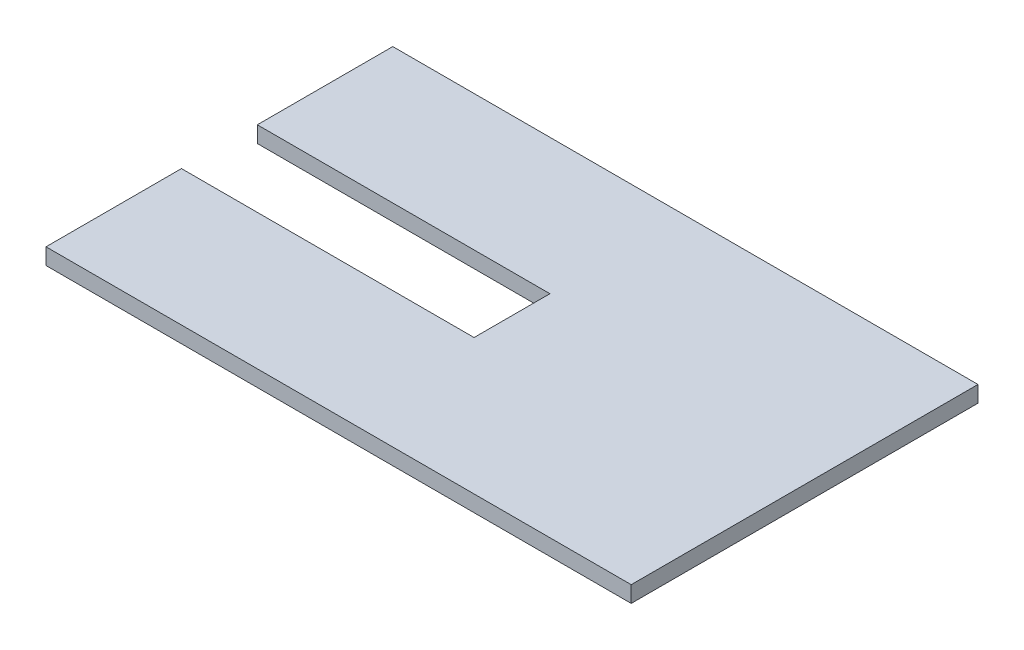
from build123d import *

# Parameters (mm, degrees)
SALIENTE_EXTRUIR1_DEPTH = 3


with BuildPart() as part:
    # Croquis1 → Saliente-Extruir1 (new body)
    with BuildSketch(Plane(origin=(0, 0, 0), x_dir=(1, 0, 0), z_dir=(0, 1, 0))):
        Polygon((-54, -32), (54, -32), (54, 32), (-54, 32), (-54, 7), (0, 7), (0, -7), (-54, -7), align=None)
    extrude(amount=SALIENTE_EXTRUIR1_DEPTH)


solid = part.part
